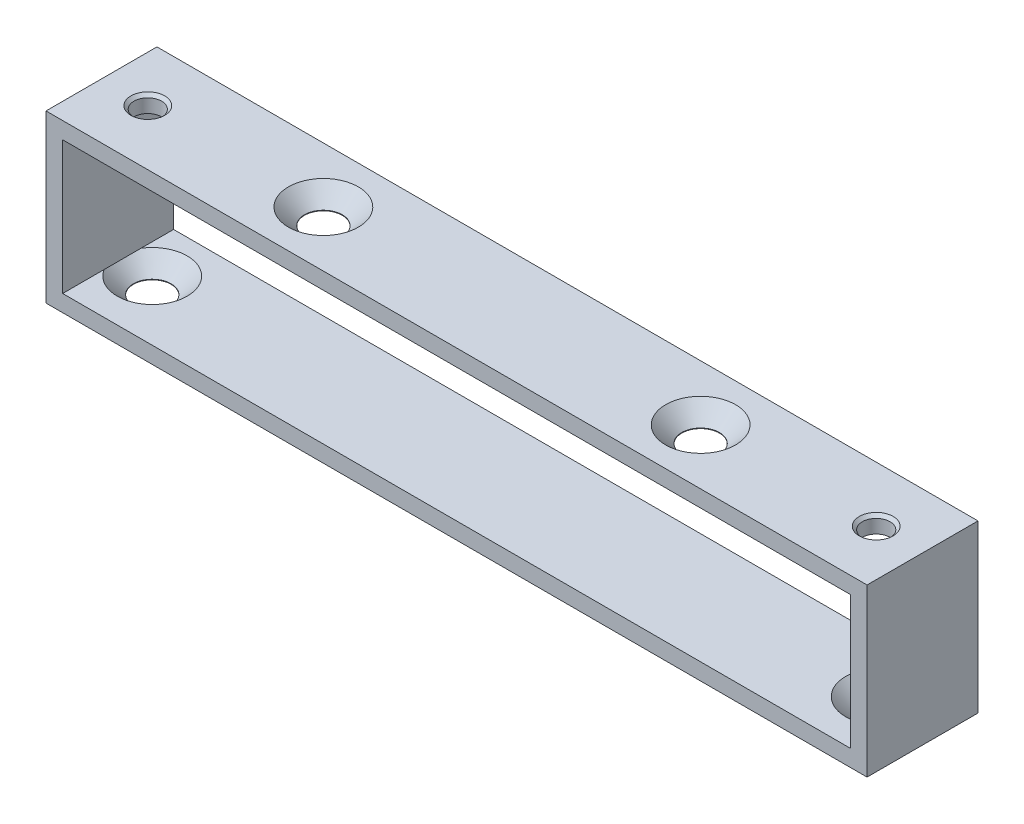
from build123d import *

# Parameters (mm, degrees)
SKIZZE1_W                                      = 74
SKIZZE1_H                                      = 15
AUFSATZ_LINEAR_AUSTRAGEN1_DEPTH                = 10
SCHNITT_LINEAR_AUSTRAGEN1_REACH                = 61.351
SKIZZE2_W                                      = 71
SKIZZE2_H                                      = 12
FORMSENKUNG_F_R_M3_LINSENSENKSCHRAUB_2_COUNT   = 2
FORMSENKUNG_F_R_M3_LINSENSENKSCHRAUB_2_PITCH   = 34
M3_GEWINDEBOHRUNG1_AT_2_COUNT                  = 2
M3_GEWINDEBOHRUNG1_AT_2_PITCH                  = 65.65
FORMSENKUNG_F_R_M3_LINSENSENKSCHRAUB_3_A_COUNT = 2
FORMSENKUNG_F_R_M3_LINSENSENKSCHRAUB_3_A_PITCH = 65.65


with BuildPart() as part:
    # Skizze1 → Aufsatz-Linear austragen1 (new body)
    with BuildSketch(Plane.XY):
        with Locations((20.392098069, -3.844827586)):
            Rectangle(SKIZZE1_W, SKIZZE1_H)
    extrude(amount=AUFSATZ_LINEAR_AUSTRAGEN1_DEPTH)

    # Skizze2 → Schnitt-Linear austragen1 (cut, up to next)
    with BuildSketch(Plane.XY.offset(10), mode=Mode.PRIVATE) as schnitt_linear_austragen1_sk1:
        with Locations((20.392098069, -3.844827586)):
            Rectangle(SKIZZE2_W, SKIZZE2_H)
    schnitt_linear_austragen1_tool1 = extrude(schnitt_linear_austragen1_sk1.sketch, amount=-SCHNITT_LINEAR_AUSTRAGEN1_REACH, mode=Mode.PRIVATE) & part.part
    add(schnitt_linear_austragen1_tool1.solids().sort_by_distance((20.392098, -3.844828, 10))[0], mode=Mode.SUBTRACT)

    # Skizze10 → Formsenkung f_r M3 Linsensenkschraube mi (revolve, cut)
    with BuildSketch(Plane(origin=(3.392098069, 3.655172414, 5), x_dir=(0, 0, 1), z_dir=(1, 0, 0))):
        Polygon((0, 0), (0, 1.5), (1.7, 1.5), (1.7, 1.45), (3.15, 0), align=None)
    formsenkung_f_r_m3_linsensenkschraube_mi = revolve(axis=Axis((3.392098069, 10.005172414, 5), (0, -1, 0)), mode=Mode.SUBTRACT)

    # Formsenkung f_r M3 Linsensenkschraub 2: Formsenkung f_r M3 Linsensenkschraube mi ×2
    with Locations(*[(i * FORMSENKUNG_F_R_M3_LINSENSENKSCHRAUB_2_PITCH, 0, 0) for i in range(1, FORMSENKUNG_F_R_M3_LINSENSENKSCHRAUB_2_COUNT)]):
        add(formsenkung_f_r_m3_linsensenkschraube_mi, mode=Mode.SUBTRACT)

    # Skizze12 → M3 Gewindebohrung1 (revolve, cut)
    with BuildSketch(Plane(origin=(53.217098069, 3.655172414, 5), x_dir=(0, 0, 1), z_dir=(1, 0, 0))):
        Polygon((0, 0), (0, 1.5), (1.25, 1.5), (1.25, 0.275), (1.525, 0), align=None)
    m3_gewindebohrung1 = revolve(axis=Axis((53.217098069, 10.005172414, 5), (0, -1, 0)), mode=Mode.SUBTRACT)

    # M3 Gewindebohrung1 at 2: M3 Gewindebohrung1 ×2
    with Locations(*[(-i * M3_GEWINDEBOHRUNG1_AT_2_PITCH, 0, 0) for i in range(1, M3_GEWINDEBOHRUNG1_AT_2_COUNT)]):
        add(m3_gewindebohrung1, mode=Mode.SUBTRACT)

    # Skizze13 → Formsenkung f_r M3 Linsensenkschraub 3 (revolve, cut)
    with BuildSketch(Plane(origin=(-12.432901931, -9.844827586, 4.6), x_dir=(0, 0, 1), z_dir=(1, 0, 0))):
        Polygon((0, 0), (0, 1.5), (1.7, 1.5), (1.7, 1.45), (3.15, 0), align=None)
    formsenkung_f_r_m3_linsensenkschraub_3 = revolve(axis=Axis((-12.432901931, -3.494827586, 4.6), (0, -1, 0)), mode=Mode.SUBTRACT)

    # Formsenkung f_r M3 Linsensenkschraub 3 a: Formsenkung f_r M3 Linsensenkschraub 3 ×2
    with Locations(*[(i * FORMSENKUNG_F_R_M3_LINSENSENKSCHRAUB_3_A_PITCH, 0, 0) for i in range(1, FORMSENKUNG_F_R_M3_LINSENSENKSCHRAUB_3_A_COUNT)]):
        add(formsenkung_f_r_m3_linsensenkschraub_3, mode=Mode.SUBTRACT)


solid = part.part
